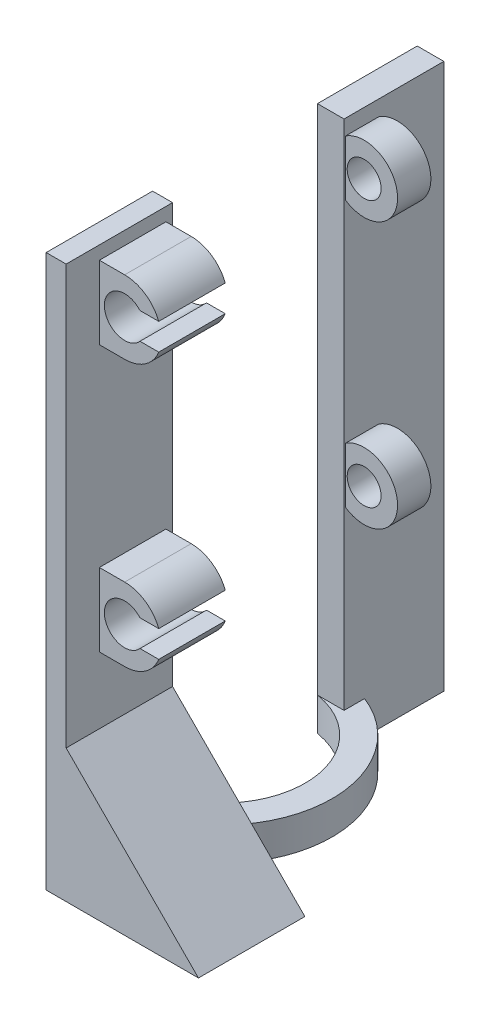
from build123d import *

# Parameters (mm, degrees)
BOSS_EXTRUDE1_DEPTH   = 10
BOSS_EXTRUDE1_2_DEPTH = 10
SKETCH2_W             = 16
SKETCH2_H             = 63
BOSS_EXTRUDE2_DEPTH   = 3
BOSS_EXTRUDE3_DEPTH   = 5
SKETCH5_W             = 4
SKETCH5_H             = 15
BOSS_EXTRUDE4_DEPTH   = 82
BOSS_EXTRUDE5_START   = 26
SKETCH7_R             = 5.029708881
BOSS_EXTRUDE5_DEPTH   = 5
SKETCH6_R             = 2.55
CUT_EXTRUDE1_DEPTH    = 30
SKETCH8_R             = 1
CUT_EXTRUDE2_DEPTH    = 1
LPATTERN1_COUNT       = 2
LPATTERN1_PITCH       = 40


with BuildPart() as part:
    # Sketch1 → Boss-Extrude1 (new body)
    with BuildSketch(Plane.XY):
        with BuildLine():
            Line((0, 5.5), (-3.799215788, 5.5))
            Line((-3.799215788, 5.5), (-3.799215788, -5.5))
            Line((-3.799215788, -5.5), (0, -5.5))
            ThreePointArc((0, -5.5), (3.102418411, -4.541475531), (5.123475383, -2))
            Line((5.123475383, -2), (2.302715788, -2))
            ThreePointArc((2.302715788, -2), (-3.05, 0), (2.302715788, 2))
            Line((2.302715788, 2), (5.123475383, 2))
            ThreePointArc((5.123475383, 2), (3.102418411, 4.541475531), (0, 5.5))
        make_face()
    extrude(amount=BOSS_EXTRUDE1_DEPTH)



with BuildPart() as body_2:
    # Sketch1 → Boss-Extrude1 2 (new body)
    with BuildSketch(Plane.XY):
        with BuildLine():
            Line((2.302715788, -38), (5.123475383, -38))
            ThreePointArc((5.123475383, -38), (3.102418411, -35.458524469), (0, -34.5))
            Line((0, -34.5), (-3.799215788, -34.5))
            Line((-3.799215788, -34.5), (-3.799215788, -45.5))
            Line((-3.799215788, -45.5), (0, -45.5))
            ThreePointArc((0, -45.5), (3.102418411, -44.541475531), (5.123475383, -42))
            Line((5.123475383, -42), (2.302715788, -42))
            ThreePointArc((2.302715788, -42), (-3.05, -40), (2.302715788, -38))
        make_face()
    extrude(amount=BOSS_EXTRUDE1_2_DEPTH)


with BuildPart() as part_1:
    add(part.part)

    add(body_2.part)  # Boss-Extrude2 merges body 2
    # Sketch2 → Boss-Extrude2 (add)
    with BuildSketch(Plane.ZY.offset(3.799215788)):
        with Locations((7, -24)):
            Rectangle(SKETCH2_W, SKETCH2_H)
    extrude(amount=BOSS_EXTRUDE2_DEPTH)

    # Sketch3 → section 1 of loft1
    with BuildSketch(Plane(origin=(0, -75.5, 0), x_dir=(-1, 0, 0), z_dir=(0, -1, 0)), mode=Mode.PRIVATE) as loft1_s1:
        with BuildLine():
            Line((6.799215788, 1), (-16.09430114, 1))
            Line((-16.09430114, 1), (-16.09430114, -15))
            Line((-16.09430114, -15), (6.799215788, -15))
            Line((6.799215788, -15), (6.799215788, 1))
        make_face()
    # loft from a face of the part (loft1)
    loft([part_1.faces().sort_by_distance((-5.299215788, -55.5, 7))[0], loft1_s1.sketch])


with BuildPart() as body_2_2:
    # Sketch4 → Boss-Extrude3 (new body)
    with BuildSketch(Plane.XZ.offset(75.5)):
        with BuildLine():
            Line((-6.799215788, 3.081354008), (-6.799215788, -1))
            ThreePointArc((-6.799215788, -1), (3.750784212, -13.389612585), (-6.799215788, -25.779225169))
            Line((-6.799215788, -25.779225169), (-6.799215788, -29.860579178))
            ThreePointArc((-6.799215788, -29.860579178), (7.792732274, -13.389612585), (-6.799215788, 3.081354008))
        make_face()
    extrude(amount=-BOSS_EXTRUDE3_DEPTH)

    # Sketch5 → Boss-Extrude4 (add)
    with BuildSketch(Plane.XZ.offset(75.5)):
        with Locations((-4.799215788, -33.279225169)):
            Rectangle(SKETCH5_W, SKETCH5_H)
    extrude(amount=-BOSS_EXTRUDE4_DEPTH)


with BuildPart() as body_3:
    # Sketch7 → Boss-Extrude5 (new body)
    with BuildSketch(Plane(origin=(0, 0, 0), x_dir=(-1, 0, 0), z_dir=(0, 0, -1)).offset(BOSS_EXTRUDE5_START)):
        Circle(SKETCH7_R)
    extrude(amount=BOSS_EXTRUDE5_DEPTH)

    # Sketch6 → Cut-Extrude1 (cut)
    with BuildSketch(Plane(origin=(0, 0, 0), x_dir=(-1, 0, 0), z_dir=(0, 0, -1))):
        Circle(SKETCH6_R)
    extrude(amount=CUT_EXTRUDE1_DEPTH, mode=Mode.SUBTRACT)

    # Sketch8 → Cut-Extrude2 (cut)
    with BuildSketch(Plane.XY.offset(-30)):
        with Locations((-1.5, 0)):
            Circle(SKETCH8_R)
        with Locations((1.5, 0)):
            Circle(SKETCH8_R)
    extrude(amount=-CUT_EXTRUDE2_DEPTH, mode=Mode.SUBTRACT)


with BuildPart() as lpattern1_1:
    # LPattern1: pattern copy
    add(body_3.part.moved(Location(Vector(0, -1, 0) * (1 * LPATTERN1_PITCH))))


solid = Compound([part_1.part, body_2_2.part, body_3.part, lpattern1_1.part])
